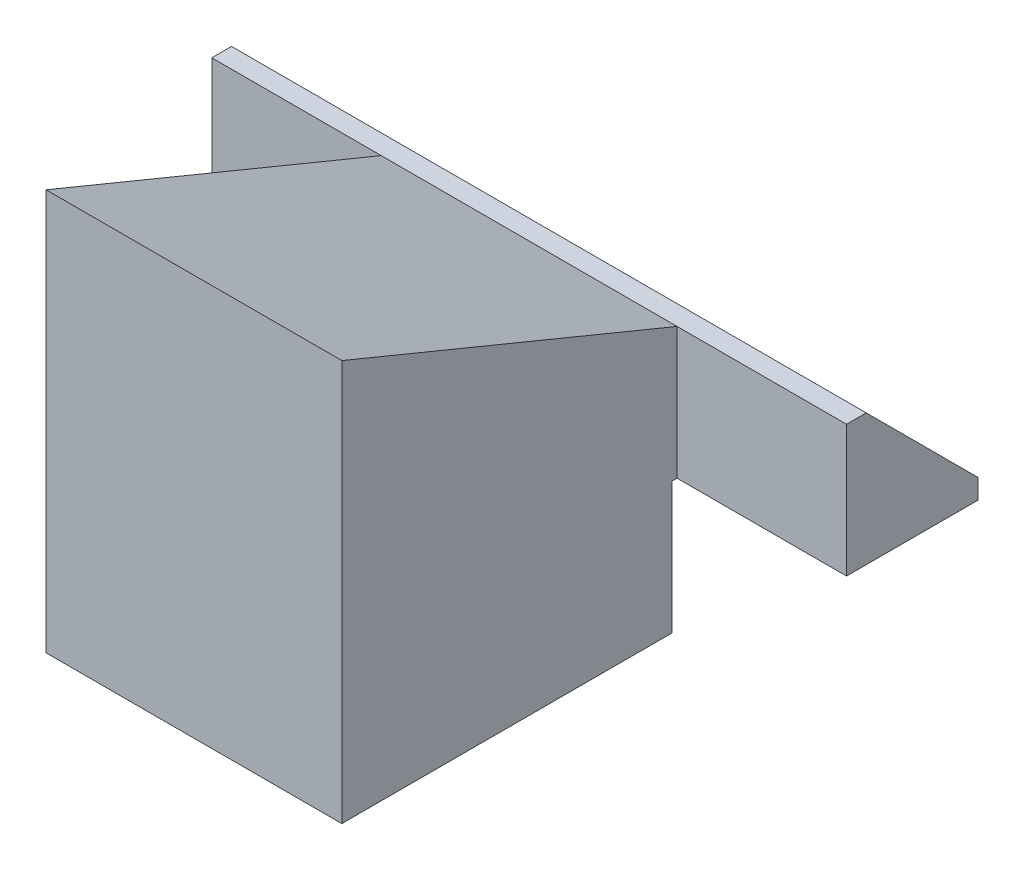
from build123d import *

# Parameters (mm, degrees)
SKETCH_1_W             = 96.558139534
SKETCH_1_H             = 40
EXTRUDE_1_DEPTH        = 51
SKETCH_2_W             = 96.558139534
SKETCH_2_H             = 20
EXTRUDE_2_DEPTH        = 20
SKETCH_4_W             = 38.279069767
SKETCH_4_H             = 17
CUT_EXTRUDE_1_DEPTH    = 17
CUT_EXTRUDE_2_DEPTH    = 112.015648944
HOLE_WIZARD_M4_1_D     = 3.8
HOLE_WIZARD_M4_1_DEPTH = 10.1
HOLE_WIZARD_M4_1_TIP   = 1.141635176
SKETCH_9_W             = 25.779069767
SKETCH_9_H             = 40
CUT_EXTRUDE_3_DEPTH    = 51
EXTRUDE_START          = -45
EXTRUDE_4_DEPTH        = 45
SKETCH_11_W            = 45
SKETCH_11_H            = 20
CUT_EXTRUDE_4_DEPTH    = 0.8


with BuildPart() as part:
    # 스케치1 → 보스-돌출1 (new body)
    with BuildSketch(Plane.XY):
        Rectangle(SKETCH_1_W, SKETCH_1_H)
    extrude(amount=EXTRUDE_1_DEPTH)

    # 스케치2 → 보스-돌출2 (add)
    with BuildSketch(Plane(origin=(0, 0, 0), x_dir=(-1, 0, 0), z_dir=(0, 0, -1))):
        with Locations((0, 10)):
            Rectangle(SKETCH_2_W, SKETCH_2_H)
    extrude(amount=EXTRUDE_2_DEPTH)

    # 스케치4 → 컷-돌출1 (cut)
    with BuildSketch(Plane(origin=(0, 20, 0), x_dir=(1, 0, 0), z_dir=(0, 1, 0))):
        with Locations((-24.139534884, 11.5)):
            Rectangle(SKETCH_4_W, SKETCH_4_H)
        with Locations((24.139534884, 11.5)):
            Rectangle(SKETCH_4_W, SKETCH_4_H)
    extrude(amount=-CUT_EXTRUDE_1_DEPTH, mode=Mode.SUBTRACT)

    # 스케치6 → 컷-돌출2 (cut, through all)
    with BuildSketch(Plane(origin=(48.279069767, 0, 0), x_dir=(0, 0, -1), z_dir=(1, 0, 0))):
        Polygon((3, 20), (20, 20), (20, 3), align=None)
    extrude(amount=-CUT_EXTRUDE_2_DEPTH, mode=Mode.SUBTRACT)

    # M4 나사 구멍1
    with Locations(Plane(origin=(0, 3, 0), x_dir=(1, 0, 0), z_dir=(0, 1, 0))):
        with Locations((-33.279069767, 10), (-15, 10), (15, 10), (33.279069767, 10)):
            Hole(HOLE_WIZARD_M4_1_D / 2, depth=HOLE_WIZARD_M4_1_DEPTH)
            with Locations((0, 0, -(HOLE_WIZARD_M4_1_DEPTH + HOLE_WIZARD_M4_1_TIP / 2))):  # 118° drill point
                Cone(0, HOLE_WIZARD_M4_1_D / 2, HOLE_WIZARD_M4_1_TIP, mode=Mode.SUBTRACT)

    # 스케치9 → 컷-돌출3 (cut)
    with BuildSketch(Plane.XY.offset(51)):
        with Locations((-35.389534884, 0)):
            Rectangle(SKETCH_9_W, SKETCH_9_H)
        with Locations((35.389534884, 0)):
            Rectangle(SKETCH_9_W, SKETCH_9_H)
    extrude(amount=-CUT_EXTRUDE_3_DEPTH, mode=Mode.SUBTRACT)

    # 스케치10 → 보스-돌출4 (add)
    with BuildSketch(Plane.ZY.offset(22.5).offset(EXTRUDE_START)):
        Polygon((51, 20), (51, 41), (0, 20), align=None)
    extrude(amount=EXTRUDE_4_DEPTH)

    # 스케치11 → 컷-돌출4 (cut)
    with BuildSketch(Plane(origin=(0, 0, 0), x_dir=(-1, 0, 0), z_dir=(0, 0, -1))):
        with Locations((0, -10)):
            Rectangle(SKETCH_11_W, SKETCH_11_H)
    extrude(amount=-CUT_EXTRUDE_4_DEPTH, mode=Mode.SUBTRACT)


solid = part.part
